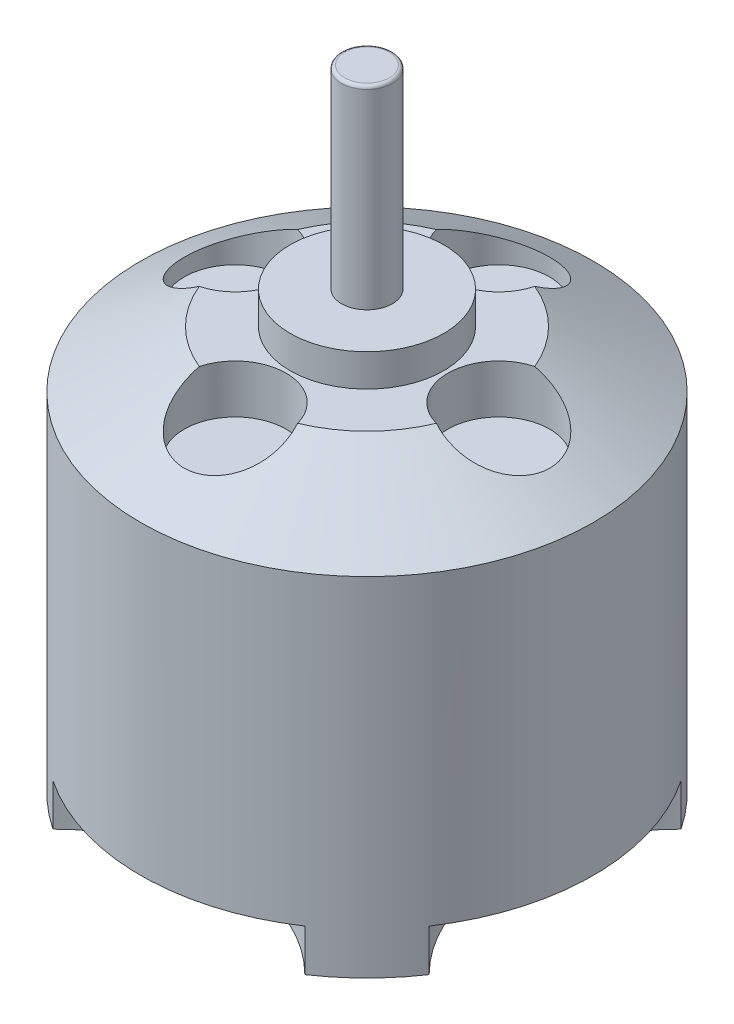
from build123d import *

# Parameters (mm, degrees)
SKETCH1_R           = 14
BOSS_EXTRUDE1_DEPTH = 25
CHAMFER1_SIZE       = 3.5
CHAMFER1_SIZE2      = 6.062177826
SKETCH2_R           = 4.75
BOSS_EXTRUDE2_DEPTH = 2
SKETCH3_R           = 1.575
BOSS_EXTRUDE3_DEPTH = 12
SKETCH4_R           = 11
CUT_EXTRUDE1_DEPTH  = 2.6
SKETCH5_R           = 1.5
SKETCH5_R_2         = 3.5
CUT_EXTRUDE2_DEPTH  = 1
CHAMFER2_SIZE       = 2
CHAMFER2_SIZE2      = 0.975465177
FILLET1_R           = 0.2
SKETCH6_R           = 3.15
CUT_EXTRUDE3_DEPTH  = 3


with BuildPart() as part:
    # Sketch1 → Boss-Extrude1 (new body)
    with BuildSketch(Plane(origin=(0, 0, 0), x_dir=(1, 0, 0), z_dir=(0, 1, 0))):
        with Locations(Location((0, 0, 0), (0, 0, 270))):
            Circle(SKETCH1_R)
    extrude(amount=BOSS_EXTRUDE1_DEPTH)

    # Chamfer1
    chamfer1_edges = [part.edges().sort_by_distance(p)[0] for p in [
        (0, 25, -14),
    ]]
    chamfer1_side = [part.faces().sort_by_distance(p)[0] for p in [
        (0, 12.5, -14),
    ]]
    chamfer(chamfer1_edges, length=CHAMFER1_SIZE, length2=CHAMFER1_SIZE2, reference=chamfer1_side[0])

    # Sketch2 → Boss-Extrude2 (add)
    with BuildSketch(Plane(origin=(0, 25, 0), x_dir=(1, 0, 0), z_dir=(0, 1, 0))):
        with Locations(Location((0, 0, 0), (0, 0, 270))):
            Circle(SKETCH2_R)
    extrude(amount=BOSS_EXTRUDE2_DEPTH)

    # Sketch3 → Boss-Extrude3 (add)
    with BuildSketch(Plane(origin=(0, 27, 0), x_dir=(1, 0, 0), z_dir=(0, 1, 0))):
        with Locations(Location((0, 0, 0), (0, 0, 270))):
            Circle(SKETCH3_R)
    extrude(amount=BOSS_EXTRUDE3_DEPTH)

    # Sketch4 → Cut-Extrude1 (cut)
    with BuildSketch(Plane.XZ):
        with Locations((-19.4, 0)):
            Circle(SKETCH4_R)
        with Locations((0, 19.4)):
            Circle(SKETCH4_R)
        with Locations((19.4, 0)):
            Circle(SKETCH4_R)
        with Locations((0, -19.4)):
            Circle(SKETCH4_R)
    extrude(amount=-CUT_EXTRUDE1_DEPTH, mode=Mode.SUBTRACT)

    # Sketch5 → Cut-Extrude2 (cut)
    with BuildSketch(Plane.XZ):
        with Locations(Location((-6.717514421, -6.717514421, 0), (0, 0, 270))):
            Circle(SKETCH5_R)
        with Locations(Location((-5.656854249, 5.656854249, 0), (0, 0, 270))):
            Circle(SKETCH5_R)
        with Locations(Location((6.717514421, 6.717514421, 0), (0, 0, 270))):
            Circle(SKETCH5_R)
        with Locations(Location((5.656854249, -5.656854249, 0), (0, 0, 270))):
            Circle(SKETCH5_R)
        with Locations(Location((0, 0, 0), (0, 0, 270))):
            Circle(SKETCH5_R_2)
    extrude(amount=-CUT_EXTRUDE2_DEPTH, mode=Mode.SUBTRACT)

    # Chamfer2
    chamfer2_edges = [part.edges().sort_by_distance(p)[0] for p in [
        (0, 0, 3.5),
    ]]
    chamfer2_side = [part.faces().sort_by_distance(p)[0] for p in [
        (0, 0, 8.070969364),
    ]]
    chamfer(chamfer2_edges, length=CHAMFER2_SIZE, length2=CHAMFER2_SIZE2, reference=chamfer2_side[0])

    # Fillet1
    fillet1_edges = [part.edges().sort_by_distance(p)[0] for p in [
        (0, 39, -1.575),
    ]]
    fillet(fillet1_edges, radius=FILLET1_R)

    # Sketch6 → Cut-Extrude3 (cut)
    with BuildSketch(Plane(origin=(0, 25, 0), x_dir=(1, 0, 0), z_dir=(0, 1, 0))):
        with Locations(Location((-8.15, 0, 0), (0, 0, 270))):
            Circle(SKETCH6_R)
        with Locations(Location((0, 8.15, 0), (0, 0, 270))):
            Circle(SKETCH6_R)
        with Locations(Location((8.15, 0, 0), (0, 0, 270))):
            Circle(SKETCH6_R)
        with Locations(Location((0, -8.15, 0), (0, 0, 270))):
            Circle(SKETCH6_R)
    extrude(amount=-CUT_EXTRUDE3_DEPTH, mode=Mode.SUBTRACT)


solid = part.part
